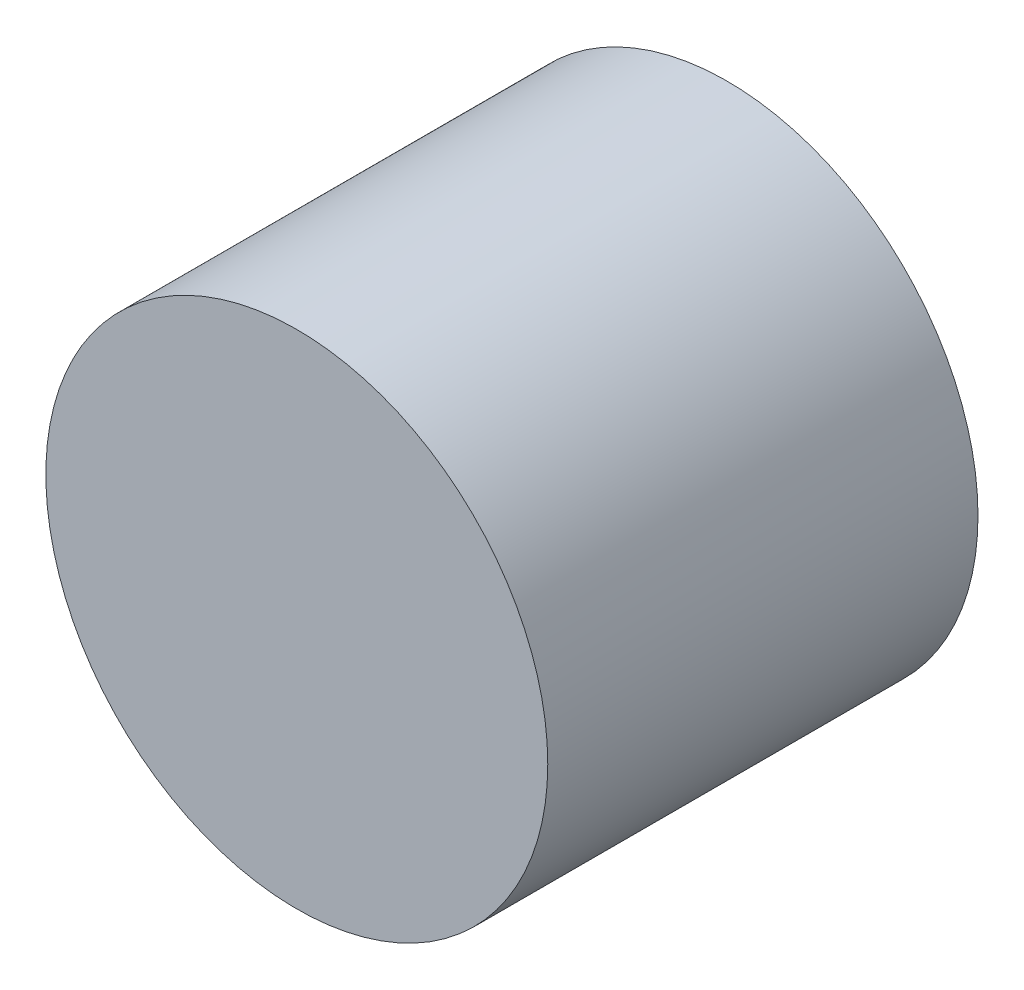
from build123d import *

# Parameters (mm, degrees)
SZKIC1_R                    = 17.5
DODANIE_WYCI_GNI_CIE1_DEPTH = 30


with BuildPart() as part:
    # Szkic1 → Dodanie-wyciągnięcie1 (new body)
    with BuildSketch(Plane.XY):
        Circle(SZKIC1_R)
    extrude(amount=DODANIE_WYCI_GNI_CIE1_DEPTH)


solid = part.part
